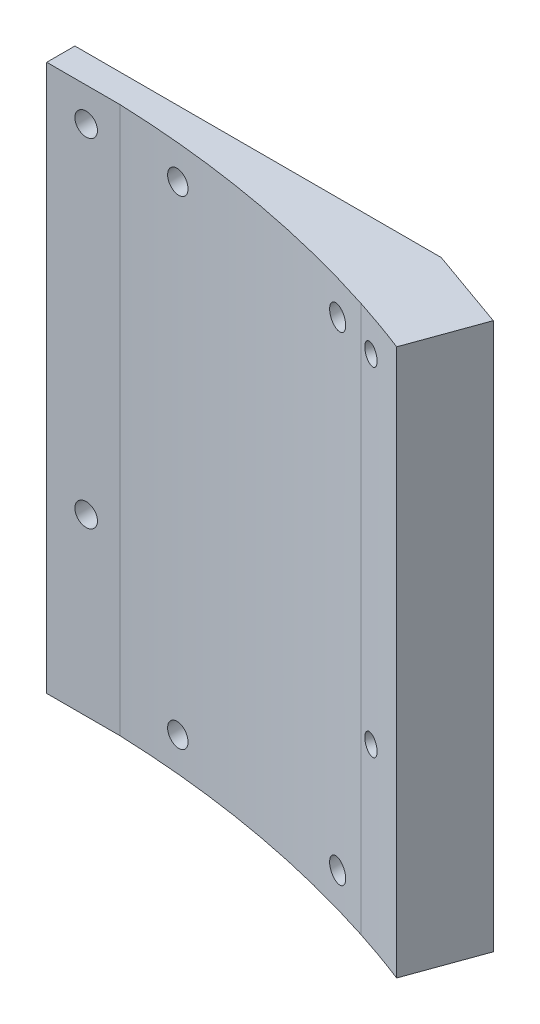
from build123d import *

# Parameters (mm, degrees)
BOSS_EXTRUDE1_DEPTH = 120
SKETCH7_R           = 2
SKETCH7_W           = 65
SKETCH7_H           = 23
CUT_EXTRUDE3_DEPTH  = 20
SKETCH8_R           = 1.75
CUT_EXTRUDE4_DEPTH  = 20


with BuildPart() as part:
    # Sketch2 → Boss-Extrude1 (new body)
    with BuildSketch(Plane(origin=(0, 0, 0), x_dir=(1, 0, 0), z_dir=(0, 1, 0))):
        with BuildLine():
            Line((7.497222042, 192.5), (58, 192.5))
            Line((58, 192.5), (72.130758111, 187.482989601))
            Line((72.130758111, 187.482989601), (72.329757157, 187.411039321))
            Line((72.329757157, 187.411039321), (67.777738536, 174.8211319))
            add(Edge.make_bspline(
                [(58, 178.303813756), (62.937238269, 176.697757749), (67.777738536, 174.8211319)],
                knots=[0, 0, 0, 1, 1, 1], degree=2))
            add(Edge.make_bspline(
                [(6, 187.5), (32.674168427, 186.491531402), (58, 178.303813756)],
                knots=[0, 0, 0, 1, 1, 1], degree=2))
            Line((6, 187.5), (-7, 187.5))
            Line((-7, 187.5), (-7, 192.5))
            Line((-7, 192.5), (7.497222042, 192.5))
        make_face()
    extrude(amount=BOSS_EXTRUDE1_DEPTH)

    # Sketch7 → Cut-Extrude3 (cut)
    with BuildSketch(Plane(origin=(0, 0, -192.5), x_dir=(-1, 0, 0), z_dir=(0, 0, -1))):
        with Locations((-17, 6)):
            Circle(SKETCH7_R)
        with Locations((-52, 6)):
            Circle(SKETCH7_R)
        with Locations((-17, 91)):
            Circle(SKETCH7_R)
        with Locations((-52, 91)):
            Circle(SKETCH7_R)
        with Locations((0, 31)):
            Circle(SKETCH7_R)
        with Locations((0, 91)):
            Circle(SKETCH7_R)
        with Locations((-25.5, 108.5)):
            Rectangle(SKETCH7_W, SKETCH7_H)
    extrude(amount=-CUT_EXTRUDE3_DEPTH, mode=Mode.SUBTRACT)

    # Sketch8 → Cut-Extrude4 (cut)
    with BuildSketch(Plane(origin=(67.187435243, 0, -189.238076061), x_dir=(-0.9423674008829427, 0, -0.33457985855865147), z_dir=(0.33457985855865147, 0, -0.9423674008829428))):
        with Locations((2.249313521, 31)):
            Circle(SKETCH8_R)
        with Locations((2.249313521, 91)):
            Circle(SKETCH8_R)
        Polygon((9.749313521, 97), (-5.245642901, 97), (-14.139279105, 97), (-14.139279105, 120), (-5.245642901, 120), (9.749313521, 120), align=None)
    extrude(amount=-CUT_EXTRUDE4_DEPTH, mode=Mode.SUBTRACT)


solid = part.part
